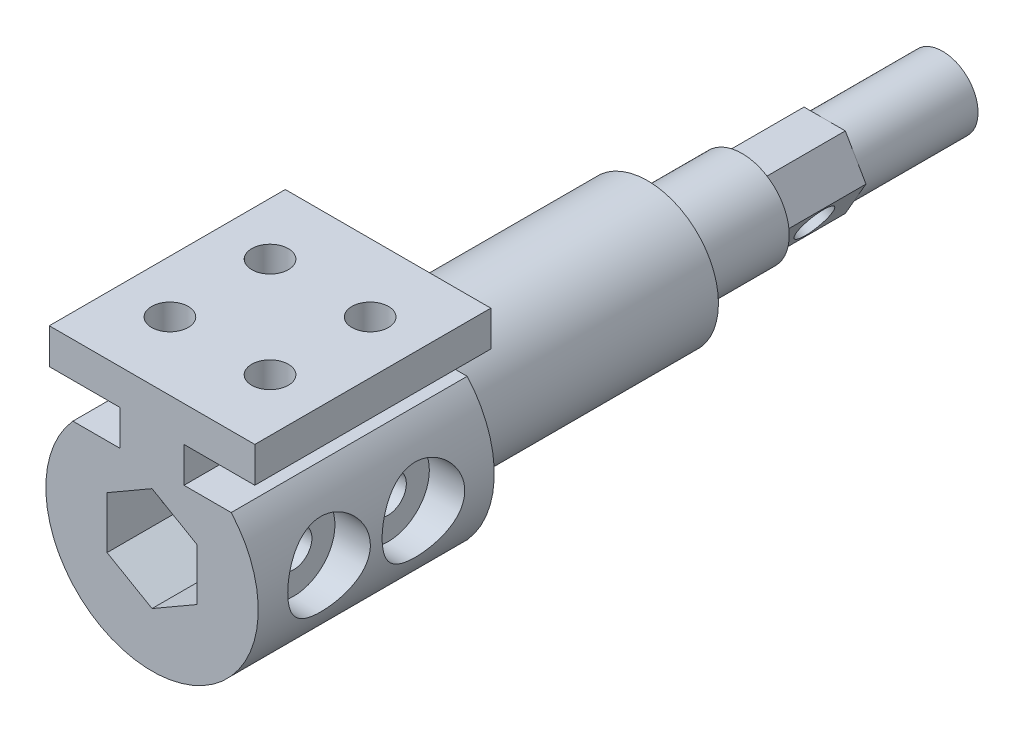
from build123d import *

# Parameters (mm, degrees)
BOSS_EXTRUDE1_DEPTH     = 20
CUT_EXTRUDE1_DEPTH      = 9
CUT_EXTRUDE1_DEPTH_BACK = 9
SKETCH8_R               = 1.55
SKETCH11_R              = 6
BOSS_EXTRUDE12_DEPTH    = 22
SKETCH12_R              = 4
BOSS_EXTRUDE13_DEPTH    = 8
BOSS_EXTRUDE14_DEPTH    = 7
SKETCH14_R              = 1.55
CUT_EXTRUDE2_DEPTH      = 6.1
SKETCH15_R              = 3
BOSS_EXTRUDE15_DEPTH    = 10
CUT_EXTRUDE5_START      = 9
SKETCH16_R              = 3.5
CUT_EXTRUDE5_DEPTH      = 3
CUT_EXTRUDE6_START      = -6
SKETCH16_2_R            = 3.5
CUT_EXTRUDE6_DEPTH      = 3
SKETCH17_R              = 1.55
CUT_EXTRUDE7_DEPTH      = 3


with BuildPart() as part:
    # Sketch1 → Boss-Extrude1 (new body)
    with BuildSketch(Plane.XY):
        with BuildLine():
            Line((-8.708203932, 12), (8.708203932, 12))
            Line((8.708203932, 12), (8.708203932, 9))
            Line((8.708203932, 9), (2.708203932, 9))
            Line((2.708203932, 9), (2.708203932, 6))
            Line((2.708203932, 6), (6.708203932, 6))
            ThreePointArc((6.708203932, 6), (0, -9), (-6.708203932, 6))
            Line((-6.708203932, 6), (-2.708203932, 6))
            Line((-2.708203932, 6), (-2.708203932, 9))
            Line((-2.708203932, 9), (-8.708203932, 9))
            Line((-8.708203932, 9), (-8.708203932, 12))
        make_face()
        Polygon((0, 4.4), (-3.810511777, 2.2), (-3.810511777, -2.2), (0, -4.4), (3.810511777, -2.2), (3.810511777, 2.2), align=None, mode=Mode.SUBTRACT)
    extrude(amount=BOSS_EXTRUDE1_DEPTH)

    # Sketch8 → Cut-Extrude1 (cut, two sides: drawn at the far end of the back side and taken through both)
    with BuildSketch(Plane.ZY.offset(-CUT_EXTRUDE1_DEPTH_BACK)):
        with Locations(Location((6, 0, 0), (0, 0, 180))):
            Circle(SKETCH8_R)
        with Locations(Location((14, 0, 0), (0, 0, 180))):
            Circle(SKETCH8_R)
    extrude(amount=CUT_EXTRUDE1_DEPTH + CUT_EXTRUDE1_DEPTH_BACK, mode=Mode.SUBTRACT)

    # Sketch11 → Boss-Extrude12 (add)
    with BuildSketch(Plane(origin=(0, 0, 0), x_dir=(-1, 0, 0), z_dir=(0, 0, -1))):
        with Locations(Location((0, 0, 0), (0, 0, 180))):
            Circle(SKETCH11_R)
    extrude(amount=BOSS_EXTRUDE12_DEPTH)

    # Sketch12 → Boss-Extrude13 (add)
    with BuildSketch(Plane(origin=(0, 0, -22), x_dir=(-1, 0, 0), z_dir=(0, 0, -1))):
        Circle(SKETCH12_R)
    extrude(amount=BOSS_EXTRUDE13_DEPTH)

    # Sketch13 → Boss-Extrude14 (add)
    with BuildSketch(Plane(origin=(0, 0, -30), x_dir=(-1, 0, 0), z_dir=(0, 0, -1))):
        Polygon((1.75, 3.031088913), (-1.75, 3.031088913), (-3.5, 0), (-1.75, -3.031088913), (1.75, -3.031088913), (3.5, 0), align=None)
    extrude(amount=BOSS_EXTRUDE14_DEPTH)

    # Sketch14 → Cut-Extrude2 (cut)
    with BuildSketch(Plane(origin=(2.625, -1.515544457, 0), x_dir=(0, 0, -1), z_dir=(0.8660254037844379, -0.5000000000000011, 0))):
        with Locations(Location((33.5, 0, 0), (0, 0, 90))):
            Circle(SKETCH14_R)
    extrude(amount=-CUT_EXTRUDE2_DEPTH, mode=Mode.SUBTRACT)

    # Sketch15 → Boss-Extrude15 (add)
    with BuildSketch(Plane(origin=(0, 0, -37), x_dir=(-1, 0, 0), z_dir=(0, 0, -1))):
        Circle(SKETCH15_R)
    extrude(amount=BOSS_EXTRUDE15_DEPTH)

    # Sketch16 → Cut-Extrude5 (cut)
    with BuildSketch(Plane.ZY.offset(CUT_EXTRUDE5_START)):
        with Locations((6, 0)):
            Circle(SKETCH16_R)
        with Locations((14, 0)):
            Circle(SKETCH16_R)
    extrude(amount=-CUT_EXTRUDE5_DEPTH, mode=Mode.SUBTRACT)

    # Sketch16<2> → Cut-Extrude6 (cut)
    with BuildSketch(Plane.ZY.offset(CUT_EXTRUDE6_START)):
        with Locations((6, 0)):
            Circle(SKETCH16_2_R)
        with Locations((14, 0)):
            Circle(SKETCH16_2_R)
    extrude(amount=-CUT_EXTRUDE6_DEPTH, mode=Mode.SUBTRACT)

    # Sketch17 → Cut-Extrude7 (cut)
    with BuildSketch(Plane(origin=(0, 12, 0), x_dir=(1, 0, 0), z_dir=(0, 1, 0))):
        with Locations(Location((-4.242640687, -5.757359313, 0), (0, 0, 270))):
            Circle(SKETCH17_R)
        with Locations(Location((4.242640687, -5.757359313, 0), (0, 0, 270))):
            Circle(SKETCH17_R)
        with Locations(Location((4.242640687, -14.242640687, 0), (0, 0, 270))):
            Circle(SKETCH17_R)
        with Locations(Location((-4.242640687, -14.242640687, 0), (0, 0, 270))):
            Circle(SKETCH17_R)
    extrude(amount=-CUT_EXTRUDE7_DEPTH, mode=Mode.SUBTRACT)


solid = part.part
